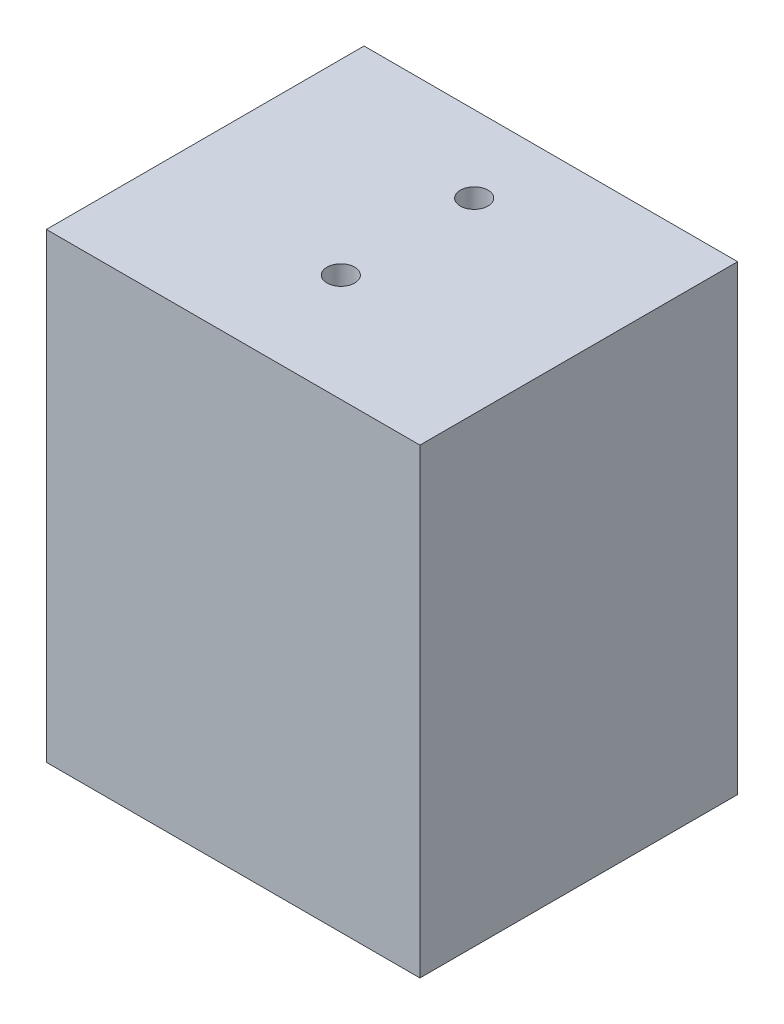
from build123d import *

# Parameters (mm, degrees)
SKETCH1_W           = 47.27
SKETCH1_H           = 58.4
BOSS_EXTRUDE1_DEPTH = 40.2
SKETCH4_R           = 1.75
CUT_EXTRUDE2_DEPTH  = 60


with BuildPart() as part:
    # Sketch1 → Boss-Extrude1 (new body)
    with BuildSketch(Plane.XY):
        with Locations((-23.691836225, -14.070929403)):
            Rectangle(SKETCH1_W, SKETCH1_H)
    extrude(amount=BOSS_EXTRUDE1_DEPTH)

    # Sketch4 → Cut-Extrude2 (cut)
    with BuildSketch(Plane.XZ.offset(43.270929403)):
        with Locations(Location((-23.691836225, 9.702218518, 0), (0, 0, 270))):
            Circle(SKETCH4_R)
        with Locations(Location((-23.691836225, 26.573715394, 0), (0, 0, 270))):
            Circle(SKETCH4_R)
    extrude(amount=-CUT_EXTRUDE2_DEPTH, mode=Mode.SUBTRACT)


solid = part.part
